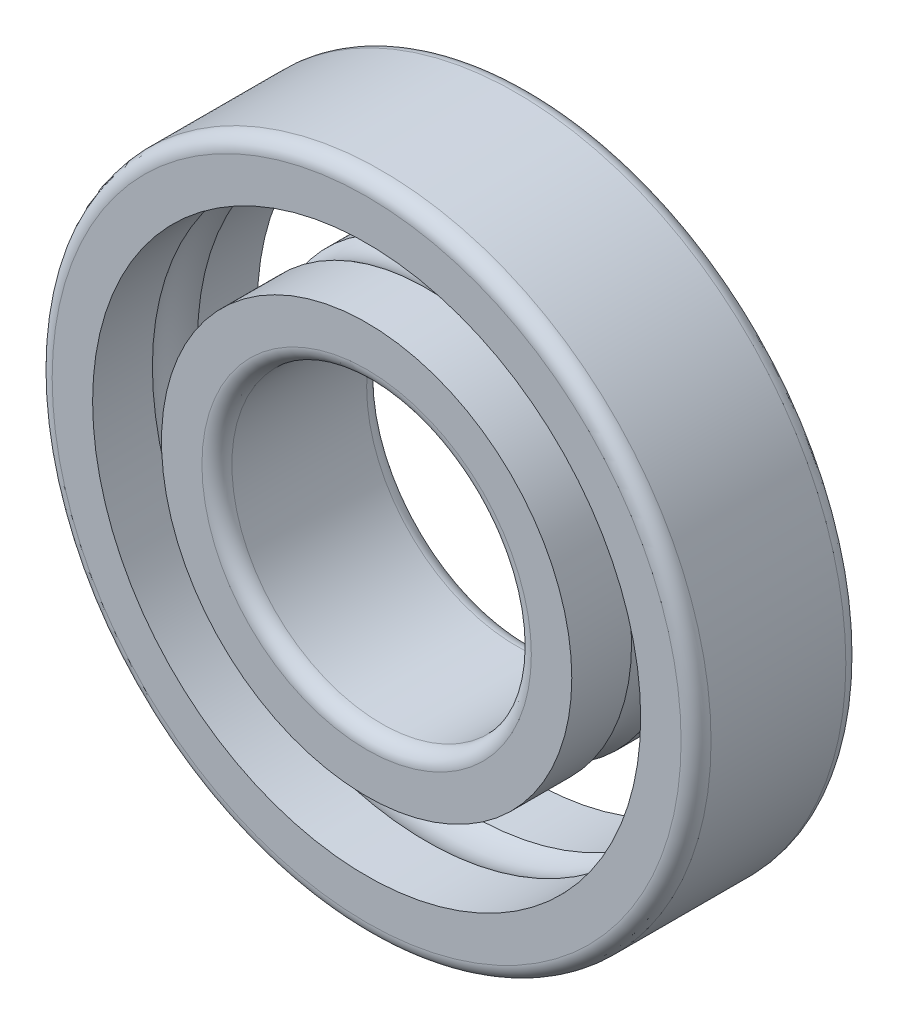
from build123d import *

# Parameters (mm, degrees)
FILLET_1_R = 1
FILLET_2_R = 1


with BuildPart() as part:
    # 草图1 → 旋转1 (revolve)
    with BuildSketch(Plane(origin=(0, 0, 0), x_dir=(1, 0, 0), z_dir=(0, 1, 0))):
        with BuildLine():
            Line((13.7, 6), (13.7, 2.007481343))
            ThreePointArc((13.7, 2.007481343), (13.25, 0.5), (13.7, -1.007481343))
            Line((13.7, -1.007481343), (13.7, -5))
            Line((13.7, -5), (10, -5))
            Line((10, -5), (10, 6))
            Line((10, 6), (13.7, 6))
        make_face()
        with BuildLine():
            Line((22, 6), (22, -5))
            Line((22, -5), (18.3, -5))
            Line((18.3, -5), (18.3, -1.007481343))
            ThreePointArc((18.3, -1.007481343), (18.75, 0.5), (18.3, 2.007481343))
            Line((18.3, 2.007481343), (18.3, 6))
            Line((18.3, 6), (22, 6))
        make_face()
    revolve(axis=Axis((0, 0, 14.270204402), (0, 0, -1)))

    # 圆角1
    fillet_1_edges = [part.edges().sort_by_distance(p)[0] for p in [
        (-22, 0, -6),
        (-22, 0, 5),
    ]]
    fillet(fillet_1_edges, radius=FILLET_1_R)

    # 圆角2
    fillet_2_edges = [part.edges().sort_by_distance(p)[0] for p in [
        (-10, 0, -6),
        (-10, 0, 5),
    ]]
    fillet(fillet_2_edges, radius=FILLET_2_R)


solid = part.part
